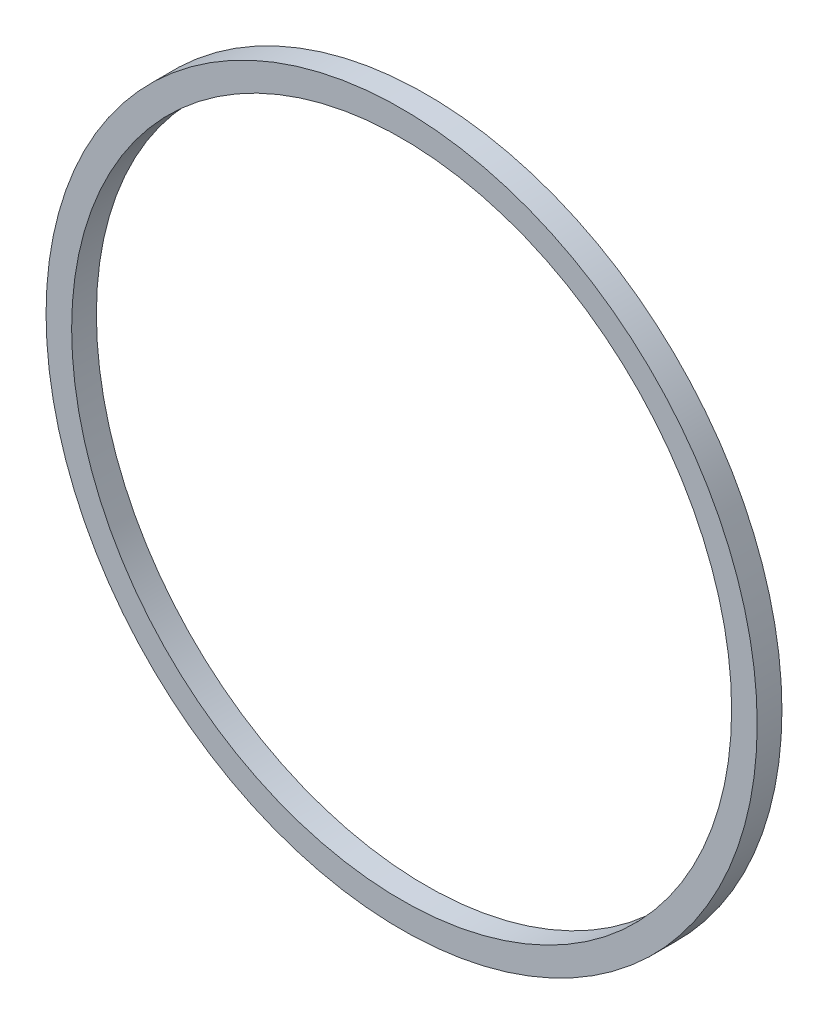
from build123d import *

# Parameters (mm, degrees)
SKETCH1_R           = 1094.74
SKETCH1_R_2         = 1016
EXTRUDE_THIN1_DEPTH = 76.2


with BuildPart() as part:
    # Sketch1 → Extrude-Thin1 (new body)
    with BuildSketch(Plane.XY):
        Circle(SKETCH1_R)
        Circle(SKETCH1_R_2, mode=Mode.SUBTRACT)
    extrude(amount=EXTRUDE_THIN1_DEPTH)


solid = part.part
